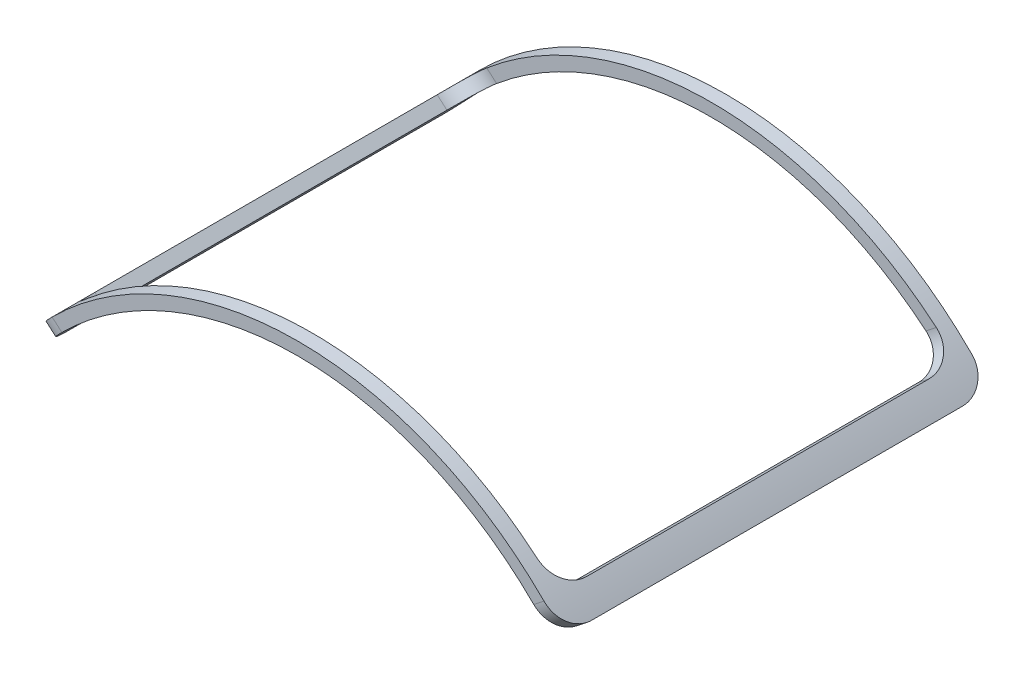
from build123d import *

# Parameters (mm, degrees)
BOSS_EXTRUDE4_DEPTH = 1500
FILLET2_R           = 100
CUT_EXTRUDE1_DEPTH  = 1400
FILLET3_R           = 100


with BuildPart() as part:
    # Sketch1 → Boss-Extrude4 (new body)
    with BuildSketch(Plane.XY):
        with BuildLine():
            Line((1835.310496497, -2.480275435), (1799.765613012, -30.447060895))
            ThreePointArc((1799.765613012, -30.447060895), (904.320634181, 384.38013336), (9.35701304, -31.484541797))
            Line((9.35701304, -31.484541797), (-24.735019353, -1.799246648))
            ThreePointArc((-24.735019353, -1.799246648), (905.445806615, 429.580248582), (1835.310496497, -2.480275435))
        make_face()
    extrude(amount=BOSS_EXTRUDE4_DEPTH)

    # Fillet2
    fillet2_edges = [part.edges().sort_by_distance(p)[0] for p in [
        (1817.538054755, -16.463668165, 1500),
        (-7.689003156, -16.641894223, 1500),
        (1817.538054755, -16.463668165, 0),
        (-7.689003156, -16.641894223, 0),
    ]]
    fillet(fillet2_edges, radius=FILLET2_R)

    # Sketch2 → Cut-Extrude1 (cut)
    with BuildSketch(Plane.XY.offset(50)):
        with BuildLine():
            Line((1767.508699471, 71.415320952), (1731.731952363, 43.266104728))
            ThreePointArc((1731.731952363, 43.266104728), (904.184365492, 384.380046478), (77.112203072, 42.114991378))
            Line((77.112203072, 42.114991378), (42.942511203, 71.867907736))
            ThreePointArc((42.942511203, 71.867907736), (905.319541026, 429.580288265), (1767.508699471, 71.415320952))
        make_face()
    extrude(amount=CUT_EXTRUDE1_DEPTH, mode=Mode.SUBTRACT)

    # Fillet3
    fillet3_edges = [part.edges().sort_by_distance(p)[0] for p in [
        (60.027357138, 56.991449557, 50),
        (1749.620325917, 57.34071284, 50),
        (60.027357138, 56.991449557, 1450),
        (1749.620325917, 57.34071284, 1450),
    ]]
    fillet(fillet3_edges, radius=FILLET3_R)


solid = part.part
